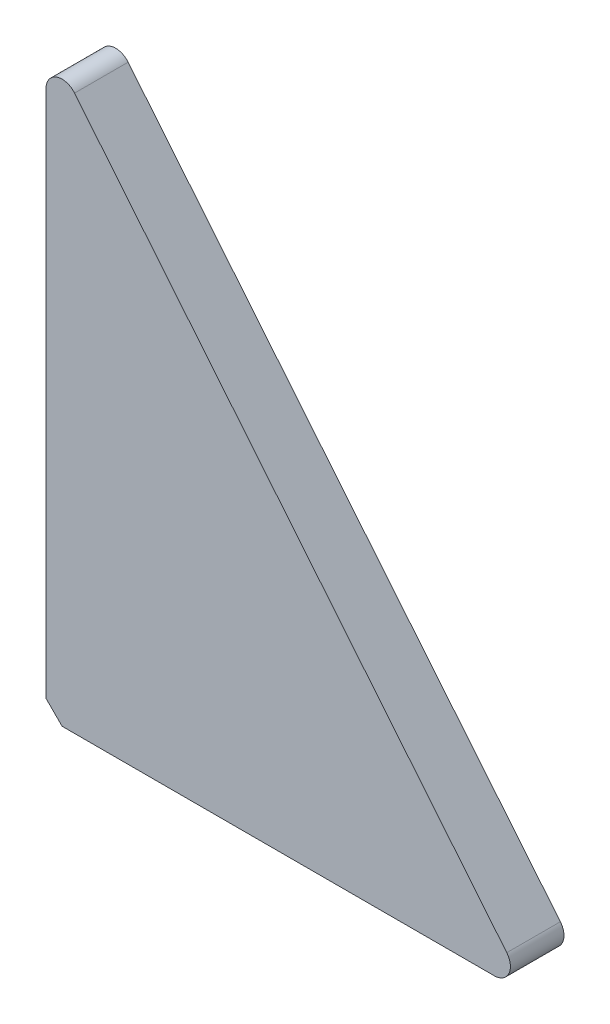
from build123d import *

# Parameters (mm, degrees)
Y_KSEKLIK_EKSTR_ZYON1_DEPTH = 10
PAH1_SIZE                   = 3
RADYUS1_R                   = 3


with BuildPart() as part:
    # Çizim1 → Yükseklik-Ekstrüzyon1 (new body)
    with BuildSketch(Plane.XY):
        Polygon((0, 0), (0, 110), (90, 0), align=None)
    extrude(amount=Y_KSEKLIK_EKSTR_ZYON1_DEPTH)

    # Pah1
    pah1_edges = [part.edges().sort_by_distance(p)[0] for p in [
        (0, 0, 5),
    ]]
    chamfer(pah1_edges, length=PAH1_SIZE)

    # Radyus1
    radyus1_edges = [part.edges().sort_by_distance(p)[0] for p in [
        (0, 110, 5),
        (90, 0, 5),
    ]]
    fillet(radyus1_edges, radius=RADYUS1_R)


solid = part.part
